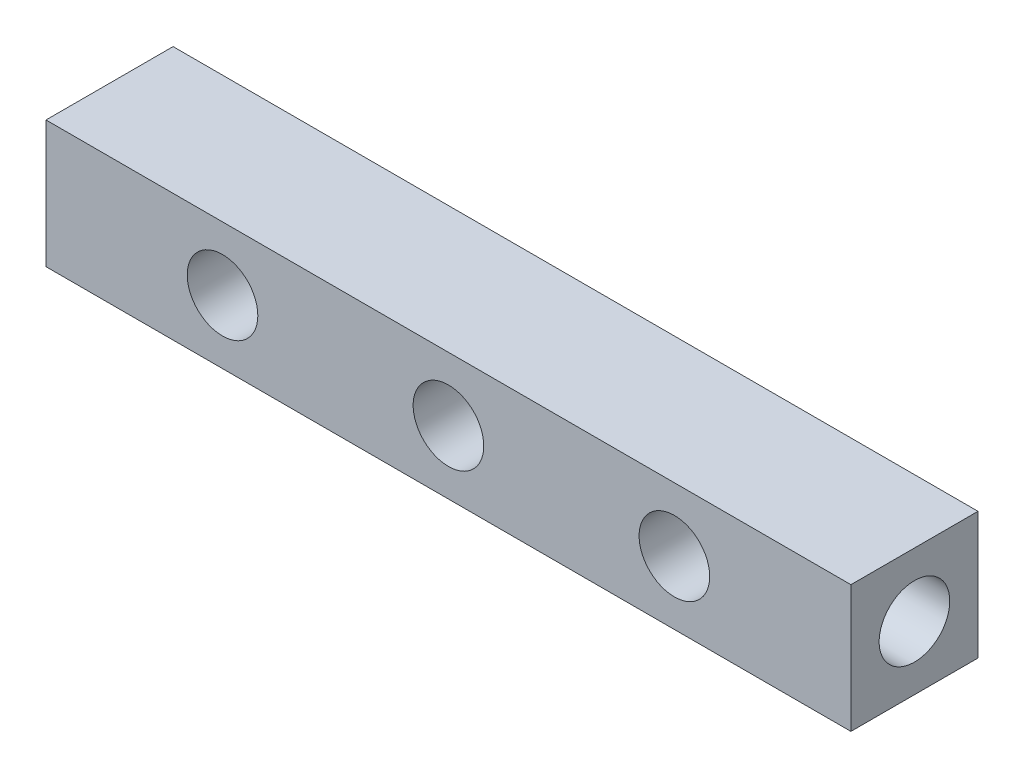
from build123d import *

# Parameters (mm, degrees)
SKETCH1_W                      = 28.5
SKETCH1_H                      = 4.5
BOSS_EXTRUDE1_DEPTH            = 4.5
SIDE_SHAFT_HOLES_M3_AT_2_COUNT = 2
SIDE_SHAFT_HOLES_M3_AT_2_PITCH = 47.562875198
M3X0_5_TAPPED_HOLE3_D          = 2.5


with BuildPart() as part:
    # Sketch1 → Boss-Extrude1 (new body)
    with BuildSketch(Plane.XY):
        with Locations((-14.25, 37.5)):
            Rectangle(SKETCH1_W, SKETCH1_H)
    extrude(amount=BOSS_EXTRUDE1_DEPTH)

    # Sketch2 → Side Shaft Holes (M3) (revolve, cut)
    with BuildSketch(Plane(origin=(0, 37.5, 2.25), x_dir=(0, 0, -1), z_dir=(0, 1, 0))):
        Polygon((0, 0), (0, 4), (1.25, 3.248924226), (1.25, 0), align=None)
    side_shaft_holes_m3 = revolve(axis=Axis((6.35, 37.5, 2.25), (-1, 0, 0)), mode=Mode.SUBTRACT)

    # Side Shaft Holes (M3) at 2: Side Shaft Holes (M3) ×2
    with Locations(*[(0, 0, -i * SIDE_SHAFT_HOLES_M3_AT_2_PITCH) for i in range(1, SIDE_SHAFT_HOLES_M3_AT_2_COUNT)]):
        add(side_shaft_holes_m3, mode=Mode.SUBTRACT)

    # Shaft Hole Mirror: Side Shaft Holes (M3) across plane
    add(side_shaft_holes_m3.mirror(Plane.ZY.offset(14.25)), mode=Mode.SUBTRACT)

    # Shaft Hole Mirror copy 1 sketch → Shaft Hole Mirror copy 1 (revolve, cut)
    with BuildSketch(Plane(origin=(-28.5, 37.5, -45.312875198), x_dir=(0, 0, -1), z_dir=(0, 1, 0))):
        Polygon((0, 0), (0, -4), (1.25, -3.248924226), (1.25, 0), align=None)
    revolve(axis=Axis((-34.85, 37.5, -45.312875198), (-1, 0, 0)), mode=Mode.SUBTRACT)

    # M3x0.5 Tapped Hole3 (through all)
    with Locations(Plane.XY.offset(4.5)):
        with Locations((-6.25, 37.5), (-14.25, 37.5), (-22.25, 37.5)):
            Hole(M3X0_5_TAPPED_HOLE3_D / 2)


solid = part.part
